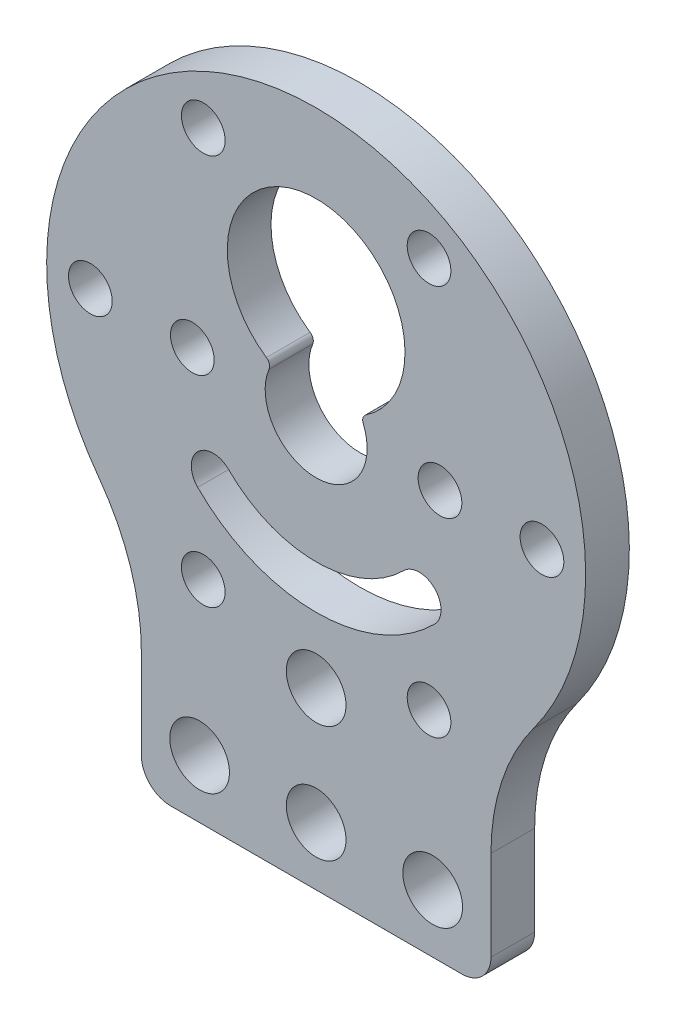
from build123d import *

# Parameters (mm, degrees)
SKETCH1_R           = 2.05
SKETCH1_R_2         = 1.5
BOSS_EXTRUDE1_DEPTH = 3


with BuildPart() as part:
    # Sketch1 → Boss-Extrude1 (new body)
    with BuildSketch(Plane.XY.offset(3)):
        with BuildLine():
            Line((-12, -26.830532015), (-12, -33))
            ThreePointArc((-12, -33), (-11.414213562, -34.414213562), (-10, -35))
            Line((-10, -35), (10, -35))
            ThreePointArc((10, -35), (11.414213562, -34.414213562), (12, -33))
            Line((12, -33), (12, -26.830532015))
            ThreePointArc((12, -26.830532015), (12.746170978, -22.15844916), (14.910447761, -17.951189322))
            ThreePointArc((14.910447761, -17.951189322), (0, 11.5), (-14.910447761, -17.951189322))
            ThreePointArc((-14.910447761, -17.951189322), (-12.746170978, -22.15844916), (-12, -26.830532015))
        make_face()
        with Locations(Location((8, -31, 0), (0, 0, 180))):
            Circle(SKETCH1_R, mode=Mode.SUBTRACT)
        with Locations(Location((-8, -31, 0), (0, 0, 180))):
            Circle(SKETCH1_R, mode=Mode.SUBTRACT)
        with Locations(Location((0, -31, 0), (0, 0, 180))):
            Circle(SKETCH1_R, mode=Mode.SUBTRACT)
        with Locations(Location((-7.75, 6.423393759, 0), (0, 0, 180))):
            Circle(SKETCH1_R_2, mode=Mode.SUBTRACT)
        with Locations(Location((7.75, 6.423393759, 0), (0, 0, 180))):
            Circle(SKETCH1_R_2, mode=Mode.SUBTRACT)
        with Locations(Location((15.5, -7, 0), (0, 0, 180))):
            Circle(SKETCH1_R_2, mode=Mode.SUBTRACT)
        with Locations(Location((7.75, -20.423393759, 0), (0, 0, 180))):
            Circle(SKETCH1_R_2, mode=Mode.SUBTRACT)
        with Locations(Location((-7.75, -20.423393759, 0), (0, 0, 180))):
            Circle(SKETCH1_R_2, mode=Mode.SUBTRACT)
        with Locations(Location((-15.5, -7, 0), (0, 0, 180))):
            Circle(SKETCH1_R_2, mode=Mode.SUBTRACT)
        with Locations(Location((-8.5, -7, 0), (0, 0, 180))):
            Circle(SKETCH1_R_2, mode=Mode.SUBTRACT)
        with Locations(Location((0, -23, 0), (0, 0, 180))):
            Circle(SKETCH1_R, mode=Mode.SUBTRACT)
        with Locations(Location((8.5, -7, 0), (0, 0, 180))):
            Circle(SKETCH1_R_2, mode=Mode.SUBTRACT)
        with BuildLine():
            ThreePointArc((3.23332646, -5.66), (0, -10.5), (-3.23332646, -5.66))
            ThreePointArc((-3.23332646, -5.66), (-3.216371052, -5.324717761), (-3.415288556, -5.054285714))
            ThreePointArc((-3.415288556, -5.054285714), (0, 6.1), (3.415288556, -5.054285714))
            ThreePointArc((3.415288556, -5.054285714), (3.216371052, -5.324717761), (3.23332646, -5.66))
        make_face(mode=Mode.SUBTRACT)
        with BuildLine():
            ThreePointArc((6.01040764, -13.01040764), (8.131727984, -13.01040764), (8.131727984, -15.131727984))
            ThreePointArc((8.131727984, -15.131727984), (0, -18.5), (-8.131727984, -15.131727984))
            ThreePointArc((-8.131727984, -15.131727984), (-8.131727984, -13.01040764), (-6.01040764, -13.01040764))
            ThreePointArc((-6.01040764, -13.01040764), (0, -15.5), (6.01040764, -13.01040764))
        make_face(mode=Mode.SUBTRACT)
    extrude(amount=-BOSS_EXTRUDE1_DEPTH)


solid = part.part
